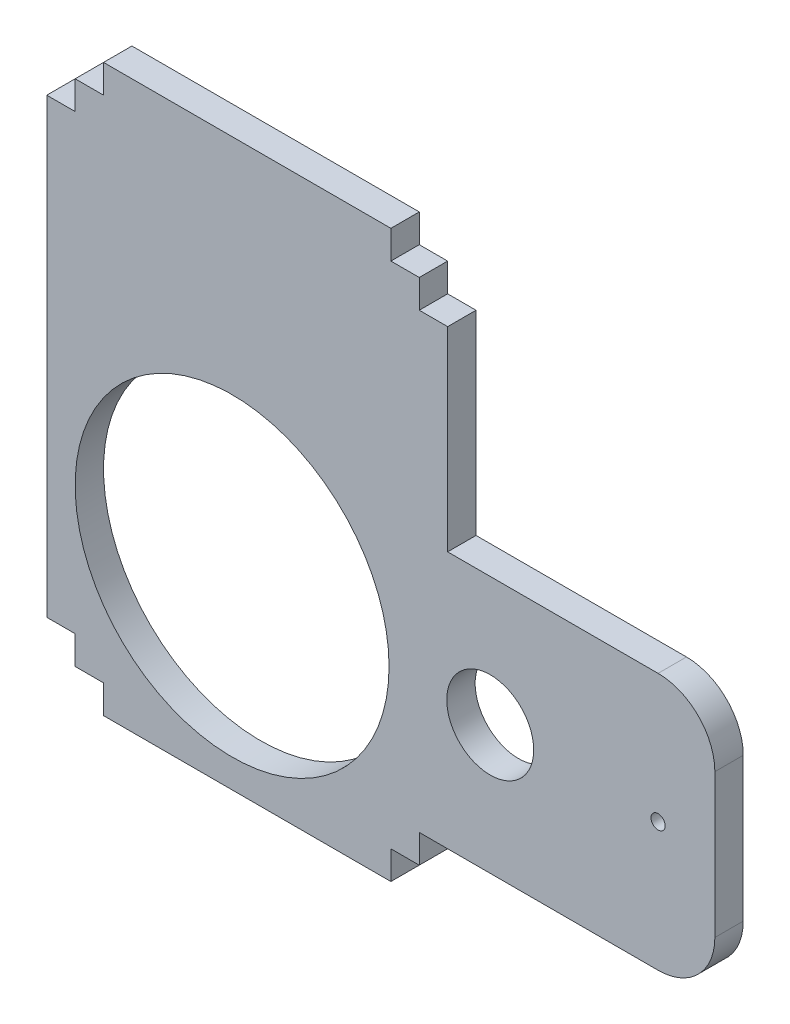
from build123d import *

# Parameters (mm, degrees)
SKETCH1_R           = 35.1155
SKETCH1_R_2         = 9.7234375
SKETCH1_R_3         = 1.5875
BOSS_EXTRUDE1_DEPTH = 6.35


with BuildPart() as part:
    # Sketch1 → Boss-Extrude1 (new body)
    with BuildSketch(Plane.XY):
        with BuildLine():
            Line((-35.1155, -35.1155), (-28.7655, -35.1155))
            Line((-28.7655, -35.1155), (-28.7655, -41.4655))
            Line((-28.7655, -41.4655), (35.5219, -41.4655))
            Line((35.5219, -41.4655), (35.5219, -35.1155))
            Line((35.5219, -35.1155), (41.8719, -35.1155))
            Line((41.8719, -35.1155), (41.8719, -28.7655))
            Line((41.8719, -28.7655), (95.3008, -28.7655))
            ThreePointArc((95.3008, -28.7655), (104.281056121, -25.045756121), (108.0008, -16.0655))
            Line((108.0008, -16.0655), (108.0008, 16.0655))
            ThreePointArc((108.0008, 16.0655), (104.281056121, 25.045756121), (95.3008, 28.7655))
            Line((95.3008, 28.7655), (48.2219, 28.7655))
            Line((48.2219, 28.7655), (48.2219, 72.4027))
            Line((48.2219, 72.4027), (41.8719, 72.4027))
            Line((41.8719, 72.4027), (41.8719, 78.7527))
            Line((41.8719, 78.7527), (35.5219, 78.7527))
            Line((35.5219, 78.7527), (35.5219, 85.1027))
            Line((35.5219, 85.1027), (-28.7655, 85.1027))
            Line((-28.7655, 85.1027), (-28.7655, 78.7527))
            Line((-28.7655, 78.7527), (-35.1155, 78.7527))
            Line((-35.1155, 78.7527), (-35.1155, 72.4027))
            Line((-35.1155, 72.4027), (-41.4655, 72.4027))
            Line((-41.4655, 72.4027), (-41.4655, -28.7655))
            Line((-41.4655, -28.7655), (-35.1155, -28.7655))
            Line((-35.1155, -28.7655), (-35.1155, -35.1155))
        make_face()
        Circle(SKETCH1_R, mode=Mode.SUBTRACT)
        with Locations((57.7469, 0)):
            Circle(SKETCH1_R_2, mode=Mode.SUBTRACT)
        with Locations((95.3008, 0)):
            Circle(SKETCH1_R_3, mode=Mode.SUBTRACT)
    extrude(amount=-BOSS_EXTRUDE1_DEPTH)


solid = part.part
